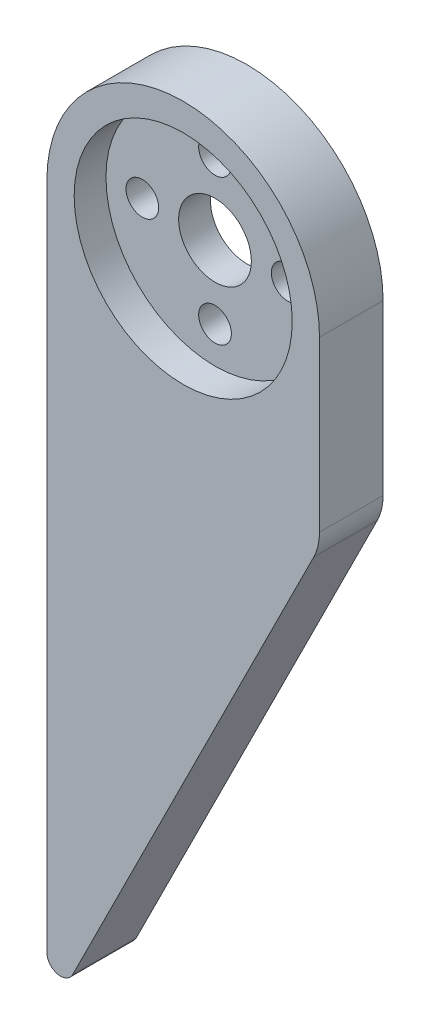
from build123d import *

# Parameters (mm, degrees)
ESQUISSE1_R             = 15
ESQUISSE1_R_2           = 1.8
ESQUISSE1_R_3           = 4
BOSS_EXTRU_1_DEPTH      = 7
CONG_1_R                = 1.5
CONG_2_R                = 6
ESQUISSE2_R             = 12
ENL_V_MAT_EXTRU_1_DEPTH = 3.5


with BuildPart() as part:
    # Esquisse1 → Boss.-Extru.1 (new body)
    # profile 1 of 2: a face of its own
    with BuildSketch(Plane.XY):
        with BuildLine():
            ThreePointArc((15, 0), (0, -15), (-15, 0))
            Line((-15, 0), (-15, -80))
            Line((-15, -80), (15, -20))
            Line((15, -20), (15, 0))
        make_face()
    # profile 2 of 2: a face of its own
    with BuildSketch(Plane.XY):
        Circle(ESQUISSE1_R)
        with Locations((-8, 0)):
            Circle(ESQUISSE1_R_2, mode=Mode.SUBTRACT)
        with Locations((0, -8)):
            Circle(ESQUISSE1_R_2, mode=Mode.SUBTRACT)
        with Locations((8, 0)):
            Circle(ESQUISSE1_R_2, mode=Mode.SUBTRACT)
        with Locations((0, 8)):
            Circle(ESQUISSE1_R_2, mode=Mode.SUBTRACT)
        Circle(ESQUISSE1_R_3, mode=Mode.SUBTRACT)
    extrude(amount=BOSS_EXTRU_1_DEPTH)

    # Congé1
    cong_1_edges = [part.edges().sort_by_distance(p)[0] for p in [
        (-15, -80, 3.5),
    ]]
    fillet(cong_1_edges, radius=CONG_1_R)

    # Congé2
    cong_2_edges = [part.edges().sort_by_distance(p)[0] for p in [
        (15, -20, 3.5),
    ]]
    fillet(cong_2_edges, radius=CONG_2_R)

    # Esquisse2 → Enlèv. mat.-Extru.1 (cut)
    with BuildSketch(Plane.XY.offset(7)):
        Circle(ESQUISSE2_R)
    extrude(amount=-ENL_V_MAT_EXTRU_1_DEPTH, mode=Mode.SUBTRACT)


solid = part.part
